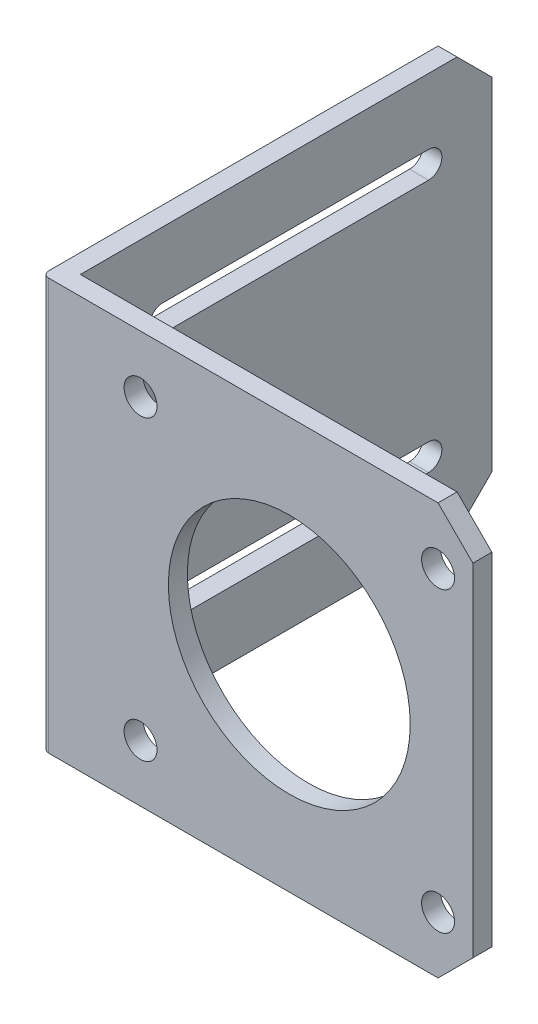
from build123d import *

# Parameters (mm, degrees)
SKETCH_1_W          = 68
SKETCH_1_H          = 65
EXTRUDE_1_DEPTH     = 68
SKETCH_2_W          = 65
SKETCH_2_H          = 65
CUT_EXTRUDE_1_DEPTH = 65
FILLET_1_R          = 1
SKETCH_6_R          = 2.6
SKETCH_6_R_2        = 19.1
CUT_EXTRUDE_4_DEPTH = 51
CUT_EXTRUDE_5_DEPTH = 51


with BuildPart() as part:
    # 草图1 → 凸台-拉伸1 (new body)
    with BuildSketch(Plane(origin=(0, 0, 0), x_dir=(0, 0, -1), z_dir=(1, 0, 0))):
        Rectangle(SKETCH_1_W, SKETCH_1_H)
    extrude(amount=EXTRUDE_1_DEPTH)

    # 草图2 → 切除-拉伸1 (cut)
    with BuildSketch(Plane(origin=(68, 0, 0), x_dir=(0, 0, -1), z_dir=(1, 0, 0))):
        with Locations((1.5, 0)):
            Rectangle(SKETCH_2_W, SKETCH_2_H)
    extrude(amount=-CUT_EXTRUDE_1_DEPTH, mode=Mode.SUBTRACT)

    # 圆角1
    fillet_1_edges = [part.edges().sort_by_distance(p)[0] for p in [
        (0, 0, 34),
    ]]
    fillet(fillet_1_edges, radius=FILLET_1_R)

    # 草图6 → 切除-拉伸4 (cut)
    with BuildSketch(Plane(origin=(0, 0, 31), x_dir=(-1, 0, 0), z_dir=(0, 0, -1))):
        with Locations((-62.5, 23.5)):
            Circle(SKETCH_6_R)
        with Locations((-15.5, 23.5)):
            Circle(SKETCH_6_R)
        with Locations((-39, 0)):
            Circle(SKETCH_6_R_2)
        with Locations((-15.5, -23.5)):
            Circle(SKETCH_6_R)
        with Locations((-62.5, -23.5)):
            Circle(SKETCH_6_R)
        Polygon((-68, 32.5), (-68, 27), (-62.5, 32.5), align=None)
        Polygon((-68, -27), (-62.5, -32.5), (-68, -32.5), align=None)
    extrude(amount=-CUT_EXTRUDE_4_DEPTH, mode=Mode.SUBTRACT)

    # 草图7 → 切除-拉伸5 (cut)
    with BuildSketch(Plane(origin=(3, 0, 0), x_dir=(0, 0, -1), z_dir=(1, 0, 0))):
        Polygon((28.5, 32.5), (34, 32.5), (34, 27), align=None)
        with BuildLine():
            Line((-18, 22.1), (24, 22.1))
            ThreePointArc((24, 22.1), (26.1, 20), (24, 17.9))
            Line((24, 17.9), (-18, 17.9))
            ThreePointArc((-18, 17.9), (-20.1, 20), (-18, 22.1))
        make_face()
        Polygon((34, -32.5), (34, -27), (28.5, -32.5), align=None)
        with BuildLine():
            Line((-18, -17.9), (24, -17.9))
            ThreePointArc((24, -17.9), (26.1, -20), (24, -22.1))
            Line((24, -22.1), (-18, -22.1))
            ThreePointArc((-18, -22.1), (-20.1, -20), (-18, -17.9))
        make_face()
    extrude(amount=-CUT_EXTRUDE_5_DEPTH, mode=Mode.SUBTRACT)


solid = part.part
